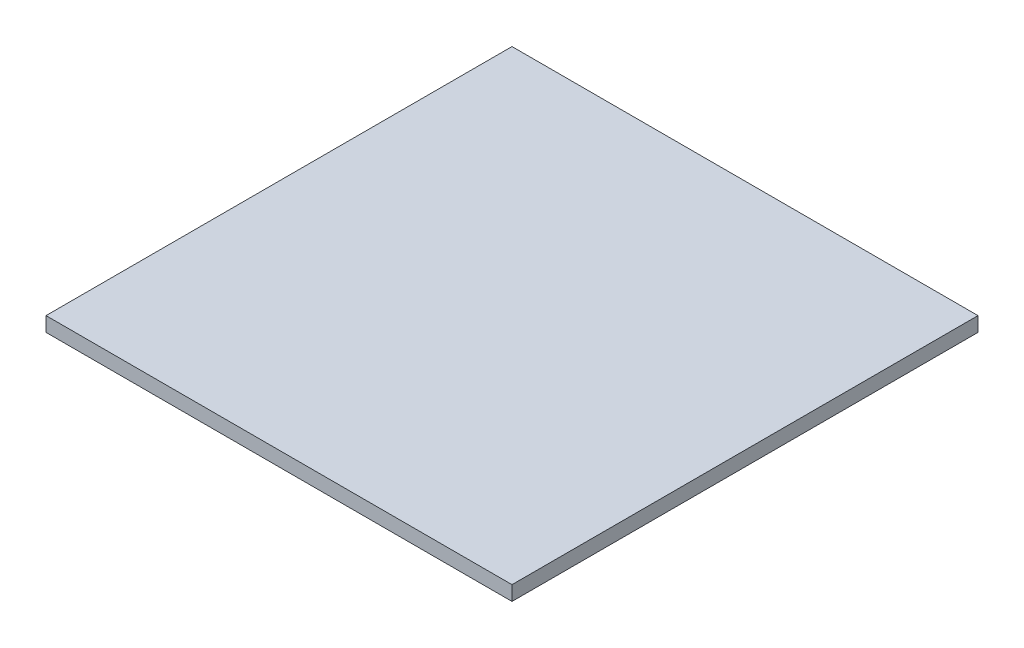
from build123d import *

# Parameters (mm, degrees)
SKETCH1_W           = 50.8
SKETCH1_H           = 50.8
BOSS_EXTRUDE1_DEPTH = 1.5875


with BuildPart() as part:
    # Sketch1 → Boss-Extrude1 (new body)
    with BuildSketch(Plane(origin=(0, 0, 0), x_dir=(1, 0, 0), z_dir=(0, 1, 0))):
        with Locations((25.4, 25.4)):
            Rectangle(SKETCH1_W, SKETCH1_H)
    extrude(amount=BOSS_EXTRUDE1_DEPTH)


solid = part.part
